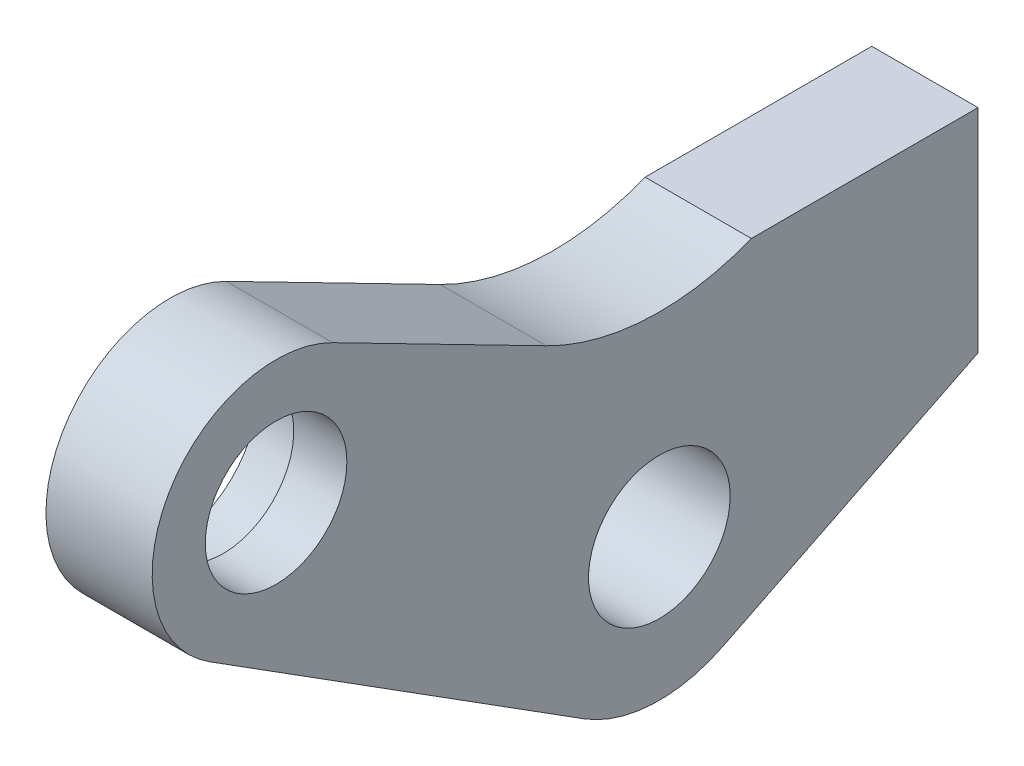
from build123d import *

# Parameters (mm, degrees)
SKETCH2_R           = 4
BOSS_EXTRUDE1_DEPTH = 6
SKETCH3_R           = 4.99
CUT_EXTRUDE1_DEPTH  = 3


with BuildPart() as part:
    # Sketch2 → Boss-Extrude1 (new body)
    with BuildSketch(Plane(origin=(0, 0, 0), x_dir=(0, 0, -1), z_dir=(1, 0, 0))):
        with BuildLine():
            Line((-47.806823021, 48.229255235), (-35.735718863, 42.04148953))
            ThreePointArc((-35.735718863, 42.04148953), (-30.003159714, 40.51527432), (-24.153212483, 41.5))
            Line((-24.153212483, 41.5), (-11.349364905, 41.5))
            Line((-11.349364905, 41.5), (-11.349364905, 29.5))
            Line((-11.349364905, 29.5), (-25.79380935, 22.333548668))
            ThreePointArc((-25.79380935, 22.333548668), (-29.761404347, 21.510618078), (-33.623291754, 22.737341551))
            Line((-33.623291754, 22.737341551), (-54.739685992, 36.082673857))
            ThreePointArc((-54.739685992, 36.082673857), (-57.079434827, 45.469938354), (-47.806823021, 48.229255235))
        make_face()
        with Locations((-51, 42)):
            Circle(SKETCH2_R, mode=Mode.SUBTRACT)
        with Locations((-29.349364905, 29.5)):
            Circle(SKETCH2_R, mode=Mode.SUBTRACT)
    extrude(amount=BOSS_EXTRUDE1_DEPTH)

    # Sketch3 → Cut-Extrude1 (cut)
    with BuildSketch(Plane.ZY):
        with Locations((51, 42)):
            Circle(SKETCH3_R)
    extrude(amount=-CUT_EXTRUDE1_DEPTH, mode=Mode.SUBTRACT)


solid = part.part
